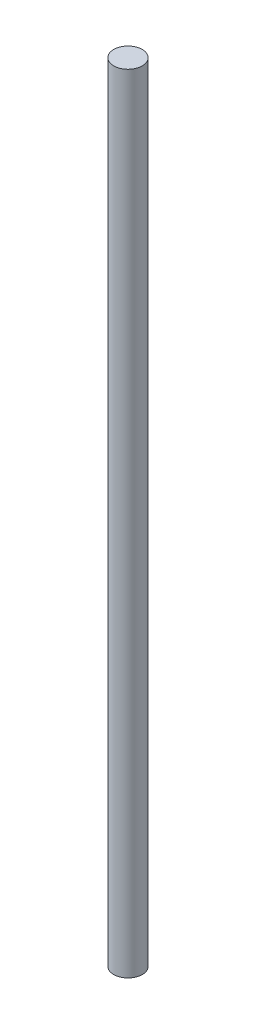
from build123d import *

# Parameters (mm, degrees)
SKETCH1_R  = 2.5
BODY_DEPTH = 138


with BuildPart() as part:
    # Sketch1 → Body (new body)
    with BuildSketch(Plane(origin=(0, 0, 0), x_dir=(1, 0, 0), z_dir=(0, 1, 0))):
        with Locations(Location((0, 0, 0), (0, 0, 270))):
            Circle(SKETCH1_R)
    extrude(amount=BODY_DEPTH)


solid = part.part
